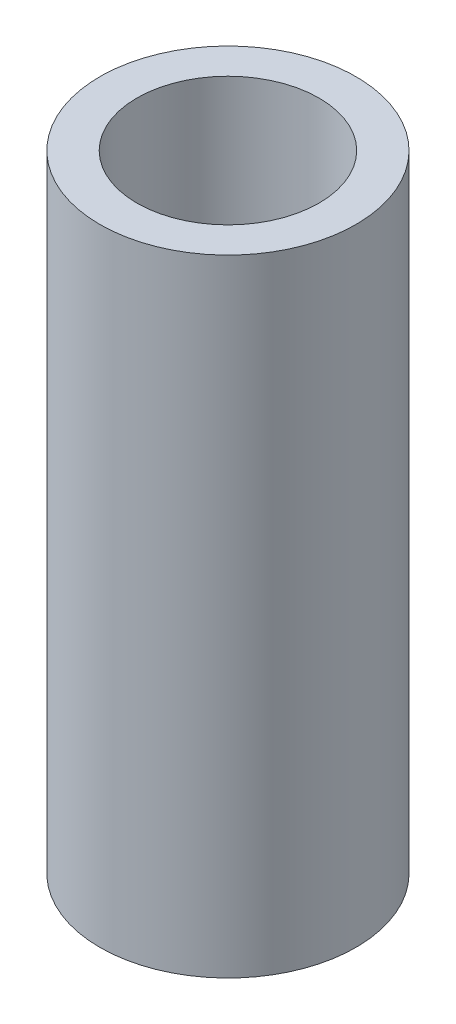
from build123d import *

# Parameters (mm, degrees)
SKETCH1_R           = 2.25
SKETCH1_R_2         = 1.6
BOSS_EXTRUDE1_DEPTH = 5.5


with BuildPart() as part:
    # Sketch1 → Boss-Extrude1 (new, symmetric)
    with BuildSketch(Plane(origin=(0, 0, 0), x_dir=(1, 0, 0), z_dir=(0, 1, 0))):
        with Locations(Location((0, 0, 0), (0, 0, 270))):
            Circle(SKETCH1_R)
        with Locations(Location((0, 0, 0), (0, 0, 270))):
            Circle(SKETCH1_R_2, mode=Mode.SUBTRACT)
    extrude(amount=BOSS_EXTRUDE1_DEPTH, both=True)


solid = part.part
